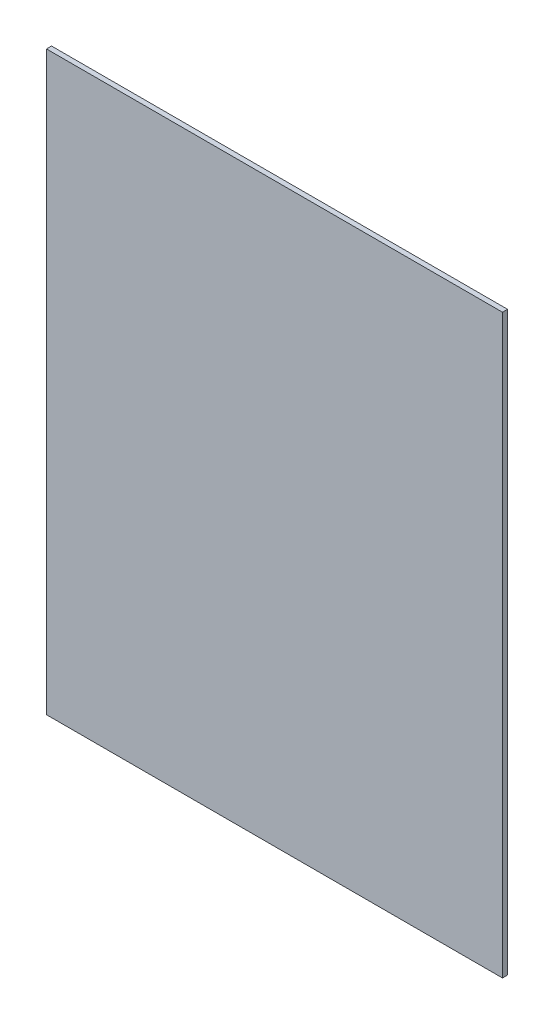
from build123d import *

# Parameters (mm, degrees)
SKETCH1_W           = 858.774
SKETCH1_H           = 1085.85
BOSS_EXTRUDE1_DEPTH = 9.525


with BuildPart() as part:
    # Sketch1 → Boss-Extrude1 (new body)
    with BuildSketch(Plane.XY):
        with Locations((393.137665514, 485.903861295)):
            Rectangle(SKETCH1_W, SKETCH1_H)
    extrude(amount=BOSS_EXTRUDE1_DEPTH)


solid = part.part
